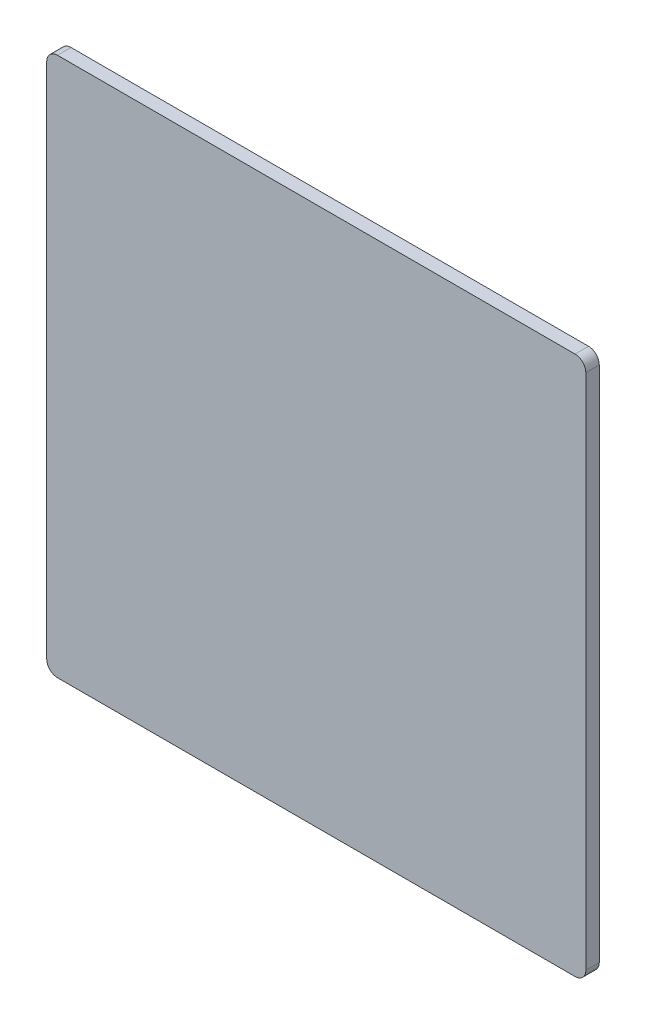
from build123d import *

# Parameters (mm, degrees)
SKETCH1_W           = 200
SKETCH1_H           = 200
BOSS_EXTRUDE1_DEPTH = 5
FILLET1_R           = 4


with BuildPart() as part:
    # Sketch1 → Boss-Extrude1 (new body)
    with BuildSketch(Plane.XY):
        Rectangle(SKETCH1_W, SKETCH1_H)
    extrude(amount=BOSS_EXTRUDE1_DEPTH)

    # Fillet1
    fillet1_edges = [part.edges().sort_by_distance(p)[0] for p in [
        (100, -100, 2.5),
        (-100, -100, 2.5),
        (-100, 100, 2.5),
        (100, 100, 2.5),
    ]]
    fillet(fillet1_edges, radius=FILLET1_R)


solid = part.part
